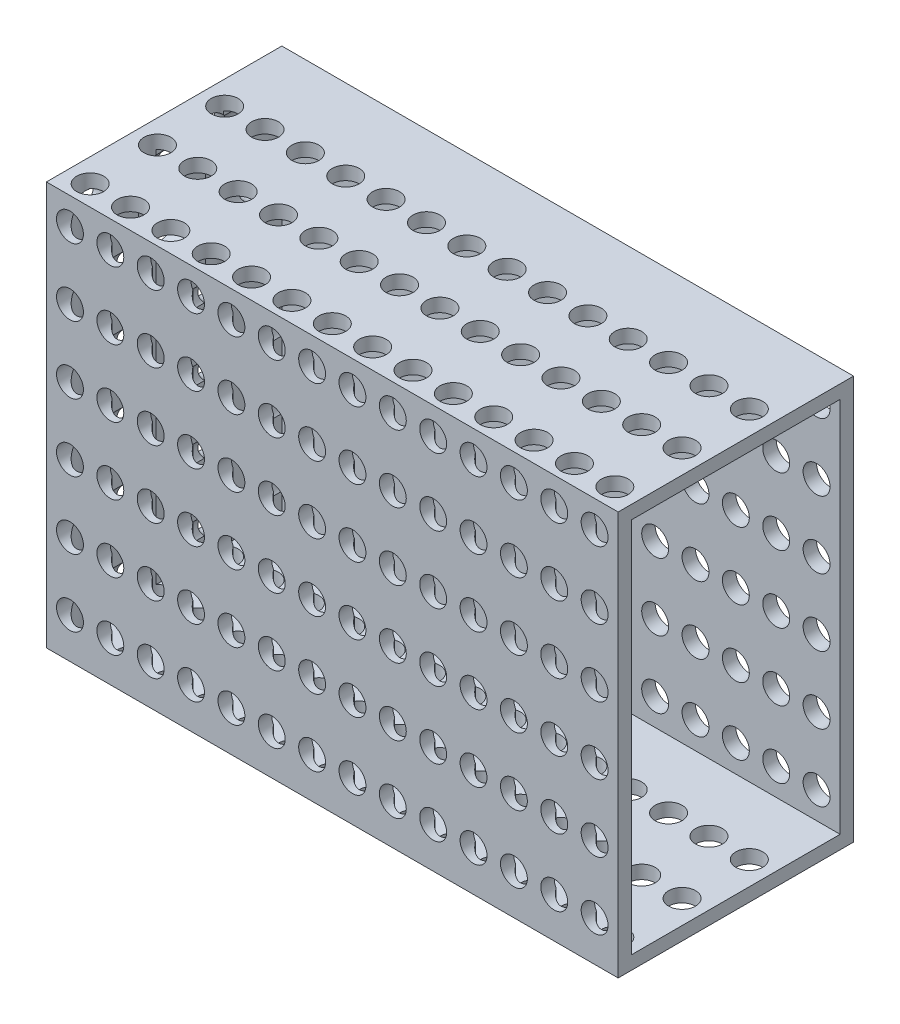
from build123d import *

# Parameters (mm, degrees)
CROQUIS2_W              = 85
CROQUIS2_H              = 60
SALIENTE_EXTRUIR1_DEPTH = 35
VACIADO1_T              = -2
CROQUIS3_R              = 2
CORTAR_EXTRUIR1_DEPTH   = 35
CROQUIS4_R              = 2
CORTAR_EXTRUIR2_DEPTH   = 65
CROQUIS5_R              = 2
CORTAR_EXTRUIR3_DEPTH   = 5


with BuildPart() as part:
    # Croquis2 → Saliente-Extruir1 (new body)
    with BuildSketch(Plane.XY):
        Rectangle(CROQUIS2_W, CROQUIS2_H)
    extrude(amount=SALIENTE_EXTRUIR1_DEPTH)

    # Vaciado1
    vaciado1_openings = [part.faces().sort_by_distance(p)[0] for p in [
        (42.5, 0, 17.5),
    ]]
    offset(amount=VACIADO1_T, openings=vaciado1_openings, kind=Kind.INTERSECTION)

    # Croquis3 → Cortar-Extruir1 (cut)
    with BuildSketch(Plane.XY.offset(35)):
        with Locations((-39, 26)):
            Circle(CROQUIS3_R)
        with Locations((-33, 26)):
            Circle(CROQUIS3_R)
        with Locations((-27, 26)):
            Circle(CROQUIS3_R)
        with Locations((-21, 26)):
            Circle(CROQUIS3_R)
        with Locations((-15, 26)):
            Circle(CROQUIS3_R)
        with Locations((-9, 26)):
            Circle(CROQUIS3_R)
        with Locations((-3, 26)):
            Circle(CROQUIS3_R)
        with Locations((3, 26)):
            Circle(CROQUIS3_R)
        with Locations((9, 26)):
            Circle(CROQUIS3_R)
        with Locations((15, 26)):
            Circle(CROQUIS3_R)
        with Locations((21, 26)):
            Circle(CROQUIS3_R)
        with Locations((27, 26)):
            Circle(CROQUIS3_R)
        with Locations((33, 26)):
            Circle(CROQUIS3_R)
        with Locations((39, 26)):
            Circle(CROQUIS3_R)
        with Locations((-33, 16)):
            Circle(CROQUIS3_R)
        with Locations((-27, 16)):
            Circle(CROQUIS3_R)
        with Locations((-21, 16)):
            Circle(CROQUIS3_R)
        with Locations((-15, 16)):
            Circle(CROQUIS3_R)
        with Locations((-9, 16)):
            Circle(CROQUIS3_R)
        with Locations((-3, 16)):
            Circle(CROQUIS3_R)
        with Locations((3, 16)):
            Circle(CROQUIS3_R)
        with Locations((9, 16)):
            Circle(CROQUIS3_R)
        with Locations((15, 16)):
            Circle(CROQUIS3_R)
        with Locations((21, 16)):
            Circle(CROQUIS3_R)
        with Locations((27, 16)):
            Circle(CROQUIS3_R)
        with Locations((33, 16)):
            Circle(CROQUIS3_R)
        with Locations((39, 16)):
            Circle(CROQUIS3_R)
        with Locations((-33, 6)):
            Circle(CROQUIS3_R)
        with Locations((-27, 6)):
            Circle(CROQUIS3_R)
        with Locations((-21, 6)):
            Circle(CROQUIS3_R)
        with Locations((-15, 6)):
            Circle(CROQUIS3_R)
        with Locations((-9, 6)):
            Circle(CROQUIS3_R)
        with Locations((-3, 6)):
            Circle(CROQUIS3_R)
        with Locations((3, 6)):
            Circle(CROQUIS3_R)
        with Locations((9, 6)):
            Circle(CROQUIS3_R)
        with Locations((15, 6)):
            Circle(CROQUIS3_R)
        with Locations((21, 6)):
            Circle(CROQUIS3_R)
        with Locations((27, 6)):
            Circle(CROQUIS3_R)
        with Locations((33, 6)):
            Circle(CROQUIS3_R)
        with Locations((39, 6)):
            Circle(CROQUIS3_R)
        with Locations((-33, -4)):
            Circle(CROQUIS3_R)
        with Locations((-27, -4)):
            Circle(CROQUIS3_R)
        with Locations((-21, -4)):
            Circle(CROQUIS3_R)
        with Locations((-15, -4)):
            Circle(CROQUIS3_R)
        with Locations((-9, -4)):
            Circle(CROQUIS3_R)
        with Locations((-3, -4)):
            Circle(CROQUIS3_R)
        with Locations((3, -4)):
            Circle(CROQUIS3_R)
        with Locations((9, -4)):
            Circle(CROQUIS3_R)
        with Locations((15, -4)):
            Circle(CROQUIS3_R)
        with Locations((21, -4)):
            Circle(CROQUIS3_R)
        with Locations((27, -4)):
            Circle(CROQUIS3_R)
        with Locations((33, -4)):
            Circle(CROQUIS3_R)
        with Locations((39, -4)):
            Circle(CROQUIS3_R)
        with Locations((-33, -14)):
            Circle(CROQUIS3_R)
        with Locations((-27, -14)):
            Circle(CROQUIS3_R)
        with Locations((-21, -14)):
            Circle(CROQUIS3_R)
        with Locations((-15, -14)):
            Circle(CROQUIS3_R)
        with Locations((-9, -14)):
            Circle(CROQUIS3_R)
        with Locations((-3, -14)):
            Circle(CROQUIS3_R)
        with Locations((3, -14)):
            Circle(CROQUIS3_R)
        with Locations((9, -14)):
            Circle(CROQUIS3_R)
        with Locations((15, -14)):
            Circle(CROQUIS3_R)
        with Locations((21, -14)):
            Circle(CROQUIS3_R)
        with Locations((27, -14)):
            Circle(CROQUIS3_R)
        with Locations((33, -14)):
            Circle(CROQUIS3_R)
        with Locations((39, -14)):
            Circle(CROQUIS3_R)
        with Locations((-33, -24)):
            Circle(CROQUIS3_R)
        with Locations((-27, -24)):
            Circle(CROQUIS3_R)
        with Locations((-21, -24)):
            Circle(CROQUIS3_R)
        with Locations((-15, -24)):
            Circle(CROQUIS3_R)
        with Locations((-9, -24)):
            Circle(CROQUIS3_R)
        with Locations((-3, -24)):
            Circle(CROQUIS3_R)
        with Locations((3, -24)):
            Circle(CROQUIS3_R)
        with Locations((9, -24)):
            Circle(CROQUIS3_R)
        with Locations((15, -24)):
            Circle(CROQUIS3_R)
        with Locations((21, -24)):
            Circle(CROQUIS3_R)
        with Locations((27, -24)):
            Circle(CROQUIS3_R)
        with Locations((33, -24)):
            Circle(CROQUIS3_R)
        with Locations((39, -24)):
            Circle(CROQUIS3_R)
        with Locations((-39, 16)):
            Circle(CROQUIS3_R)
        with Locations((-39, 6)):
            Circle(CROQUIS3_R)
        with Locations((-39, -4)):
            Circle(CROQUIS3_R)
        with Locations((-39, -14)):
            Circle(CROQUIS3_R)
        with Locations((-39, -24)):
            Circle(CROQUIS3_R)
    extrude(amount=-CORTAR_EXTRUIR1_DEPTH, mode=Mode.SUBTRACT)

    # Croquis4 → Cortar-Extruir2 (cut)
    with BuildSketch(Plane.XZ.offset(30)):
        with Locations(Location((-39, 32, 0), (0, 0, 270))):
            Circle(CROQUIS4_R)
        with Locations(Location((-33, 32, 0), (0, 0, 270))):
            Circle(CROQUIS4_R)
        with Locations(Location((-27, 32, 0), (0, 0, 270))):
            Circle(CROQUIS4_R)
        with Locations(Location((-21, 32, 0), (0, 0, 270))):
            Circle(CROQUIS4_R)
        with Locations(Location((-15, 32, 0), (0, 0, 270))):
            Circle(CROQUIS4_R)
        with Locations(Location((-9, 32, 0), (0, 0, 270))):
            Circle(CROQUIS4_R)
        with Locations(Location((-3, 32, 0), (0, 0, 270))):
            Circle(CROQUIS4_R)
        with Locations(Location((3, 32, 0), (0, 0, 270))):
            Circle(CROQUIS4_R)
        with Locations(Location((9, 32, 0), (0, 0, 270))):
            Circle(CROQUIS4_R)
        with Locations(Location((15, 32, 0), (0, 0, 270))):
            Circle(CROQUIS4_R)
        with Locations(Location((21, 32, 0), (0, 0, 270))):
            Circle(CROQUIS4_R)
        with Locations(Location((27, 32, 0), (0, 0, 270))):
            Circle(CROQUIS4_R)
        with Locations(Location((33, 32, 0), (0, 0, 270))):
            Circle(CROQUIS4_R)
        with Locations(Location((39, 32, 0), (0, 0, 270))):
            Circle(CROQUIS4_R)
        with Locations(Location((-33, 22, 0), (0, 0, 270))):
            Circle(CROQUIS4_R)
        with Locations(Location((-27, 22, 0), (0, 0, 270))):
            Circle(CROQUIS4_R)
        with Locations(Location((-21, 22, 0), (0, 0, 270))):
            Circle(CROQUIS4_R)
        with Locations(Location((-15, 22, 0), (0, 0, 270))):
            Circle(CROQUIS4_R)
        with Locations(Location((-9, 22, 0), (0, 0, 270))):
            Circle(CROQUIS4_R)
        with Locations(Location((-3, 22, 0), (0, 0, 270))):
            Circle(CROQUIS4_R)
        with Locations(Location((3, 22, 0), (0, 0, 270))):
            Circle(CROQUIS4_R)
        with Locations(Location((9, 22, 0), (0, 0, 270))):
            Circle(CROQUIS4_R)
        with Locations(Location((15, 22, 0), (0, 0, 270))):
            Circle(CROQUIS4_R)
        with Locations(Location((21, 22, 0), (0, 0, 270))):
            Circle(CROQUIS4_R)
        with Locations(Location((27, 22, 0), (0, 0, 270))):
            Circle(CROQUIS4_R)
        with Locations(Location((33, 22, 0), (0, 0, 270))):
            Circle(CROQUIS4_R)
        with Locations(Location((39, 22, 0), (0, 0, 270))):
            Circle(CROQUIS4_R)
        with Locations(Location((-33, 12, 0), (0, 0, 270))):
            Circle(CROQUIS4_R)
        with Locations(Location((-27, 12, 0), (0, 0, 270))):
            Circle(CROQUIS4_R)
        with Locations(Location((-21, 12, 0), (0, 0, 270))):
            Circle(CROQUIS4_R)
        with Locations(Location((-15, 12, 0), (0, 0, 270))):
            Circle(CROQUIS4_R)
        with Locations(Location((-9, 12, 0), (0, 0, 270))):
            Circle(CROQUIS4_R)
        with Locations(Location((-3, 12, 0), (0, 0, 270))):
            Circle(CROQUIS4_R)
        with Locations(Location((3, 12, 0), (0, 0, 270))):
            Circle(CROQUIS4_R)
        with Locations(Location((9, 12, 0), (0, 0, 270))):
            Circle(CROQUIS4_R)
        with Locations(Location((15, 12, 0), (0, 0, 270))):
            Circle(CROQUIS4_R)
        with Locations(Location((21, 12, 0), (0, 0, 270))):
            Circle(CROQUIS4_R)
        with Locations(Location((27, 12, 0), (0, 0, 270))):
            Circle(CROQUIS4_R)
        with Locations(Location((33, 12, 0), (0, 0, 270))):
            Circle(CROQUIS4_R)
        with Locations(Location((39, 12, 0), (0, 0, 270))):
            Circle(CROQUIS4_R)
        with Locations(Location((-39, 22, 0), (0, 0, 270))):
            Circle(CROQUIS4_R)
        with Locations(Location((-39, 12, 0), (0, 0, 270))):
            Circle(CROQUIS4_R)
    extrude(amount=-CORTAR_EXTRUIR2_DEPTH, mode=Mode.SUBTRACT)

    # Croquis5 → Cortar-Extruir3 (cut)
    with BuildSketch(Plane.ZY.offset(42.5)):
        with Locations((30, 26)):
            Circle(CROQUIS5_R)
        with Locations((24, 26)):
            Circle(CROQUIS5_R)
        with Locations((18, 26)):
            Circle(CROQUIS5_R)
        with Locations((12, 26)):
            Circle(CROQUIS5_R)
        with Locations((6, 26)):
            Circle(CROQUIS5_R)
        with Locations((24, 16)):
            Circle(CROQUIS5_R)
        with Locations((18, 16)):
            Circle(CROQUIS5_R)
        with Locations((12, 16)):
            Circle(CROQUIS5_R)
        with Locations((6, 16)):
            Circle(CROQUIS5_R)
        with Locations((24, 6)):
            Circle(CROQUIS5_R)
        with Locations((18, 6)):
            Circle(CROQUIS5_R)
        with Locations((12, 6)):
            Circle(CROQUIS5_R)
        with Locations((6, 6)):
            Circle(CROQUIS5_R)
        with Locations((24, -4)):
            Circle(CROQUIS5_R)
        with Locations((18, -4)):
            Circle(CROQUIS5_R)
        with Locations((12, -4)):
            Circle(CROQUIS5_R)
        with Locations((6, -4)):
            Circle(CROQUIS5_R)
        with Locations((24, -14)):
            Circle(CROQUIS5_R)
        with Locations((18, -14)):
            Circle(CROQUIS5_R)
        with Locations((12, -14)):
            Circle(CROQUIS5_R)
        with Locations((6, -14)):
            Circle(CROQUIS5_R)
        with Locations((24, -24)):
            Circle(CROQUIS5_R)
        with Locations((18, -24)):
            Circle(CROQUIS5_R)
        with Locations((12, -24)):
            Circle(CROQUIS5_R)
        with Locations((6, -24)):
            Circle(CROQUIS5_R)
        with Locations((30, 16)):
            Circle(CROQUIS5_R)
        with Locations((30, 6)):
            Circle(CROQUIS5_R)
        with Locations((30, -4)):
            Circle(CROQUIS5_R)
        with Locations((30, -14)):
            Circle(CROQUIS5_R)
        with Locations((30, -24)):
            Circle(CROQUIS5_R)
    extrude(amount=-CORTAR_EXTRUIR3_DEPTH, mode=Mode.SUBTRACT)


solid = part.part
